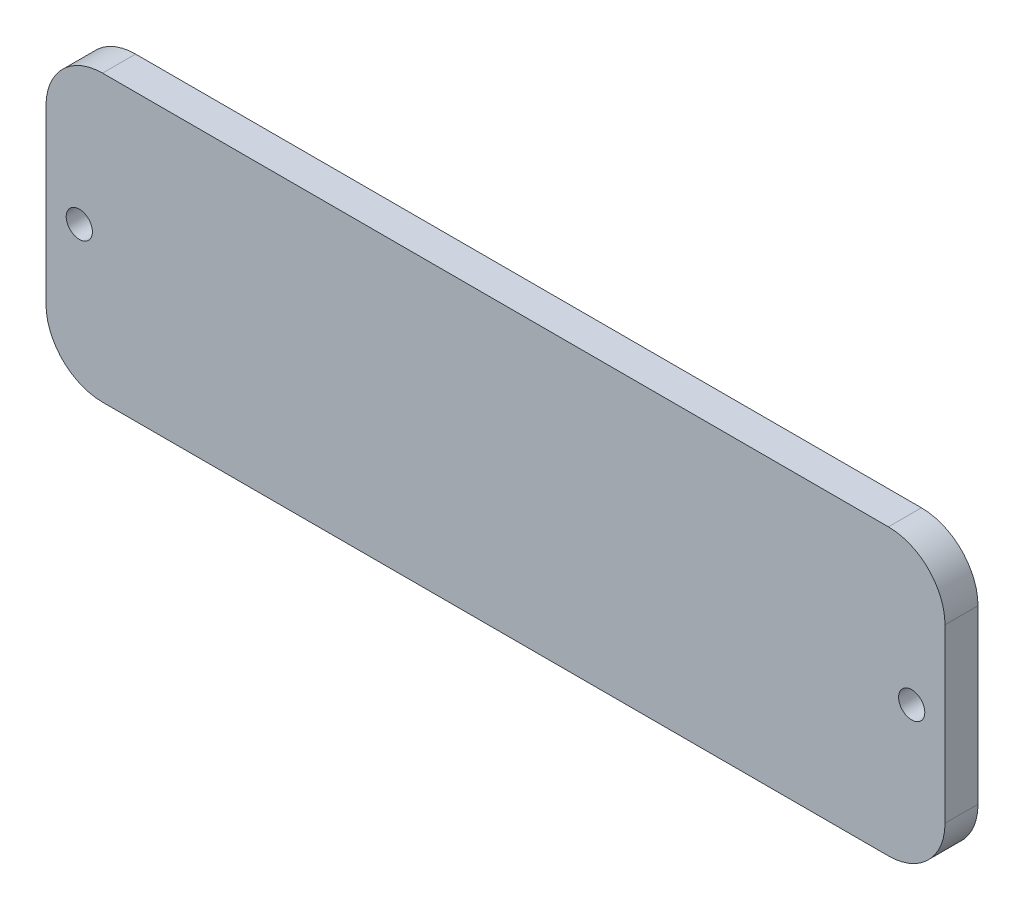
from build123d import *

# Parameters (mm, degrees)
BOSS_EXTRUDE1_DEPTH                = 2
F_1_16_0_0625_DIAMETER_HOLE2_D     = 1.5875
F_1_16_0_0625_DIAMETER_HOLE2_DEPTH = 19.05
F_1_16_0_0625_DIAMETER_HOLE2_TIP   = 0.476933116


with BuildPart() as part:
    # Sketch1 → Boss-Extrude1 (new body)
    with BuildSketch(Plane(origin=(0, 0, -49.2125), x_dir=(-1, 0, 0), z_dir=(0, 0, -1))):
        with BuildLine():
            Line((23.8125, 8.636), (-23.8125, 8.636))
            ThreePointArc((-23.8125, 8.636), (-26.237169153, 7.631669153), (-27.2415, 5.207))
            Line((-27.2415, 5.207), (-27.2415, -5.207))
            ThreePointArc((-27.2415, -5.207), (-26.237169153, -7.631669153), (-23.8125, -8.636))
            Line((-23.8125, -8.636), (23.8125, -8.636))
            ThreePointArc((23.8125, -8.636), (26.237169153, -7.631669153), (27.2415, -5.207))
            Line((27.2415, -5.207), (27.2415, 5.207))
            ThreePointArc((27.2415, 5.207), (26.237169153, 7.631669153), (23.8125, 8.636))
        make_face()
    extrude(amount=-BOSS_EXTRUDE1_DEPTH)

    # 1/16 (0.0625) Diameter Hole2
    with Locations(Plane(origin=(25.223, 0, -47.2125), x_dir=(1, 0, 0), z_dir=(0, 0, 1))):
        with Locations((0, 0), (-50.446, 0)):
            Hole(F_1_16_0_0625_DIAMETER_HOLE2_D / 2, depth=F_1_16_0_0625_DIAMETER_HOLE2_DEPTH)
            with Locations((0, 0, -(F_1_16_0_0625_DIAMETER_HOLE2_DEPTH + F_1_16_0_0625_DIAMETER_HOLE2_TIP / 2))):  # 118° drill point
                Cone(0, F_1_16_0_0625_DIAMETER_HOLE2_D / 2, F_1_16_0_0625_DIAMETER_HOLE2_TIP, mode=Mode.SUBTRACT)


solid = part.part
